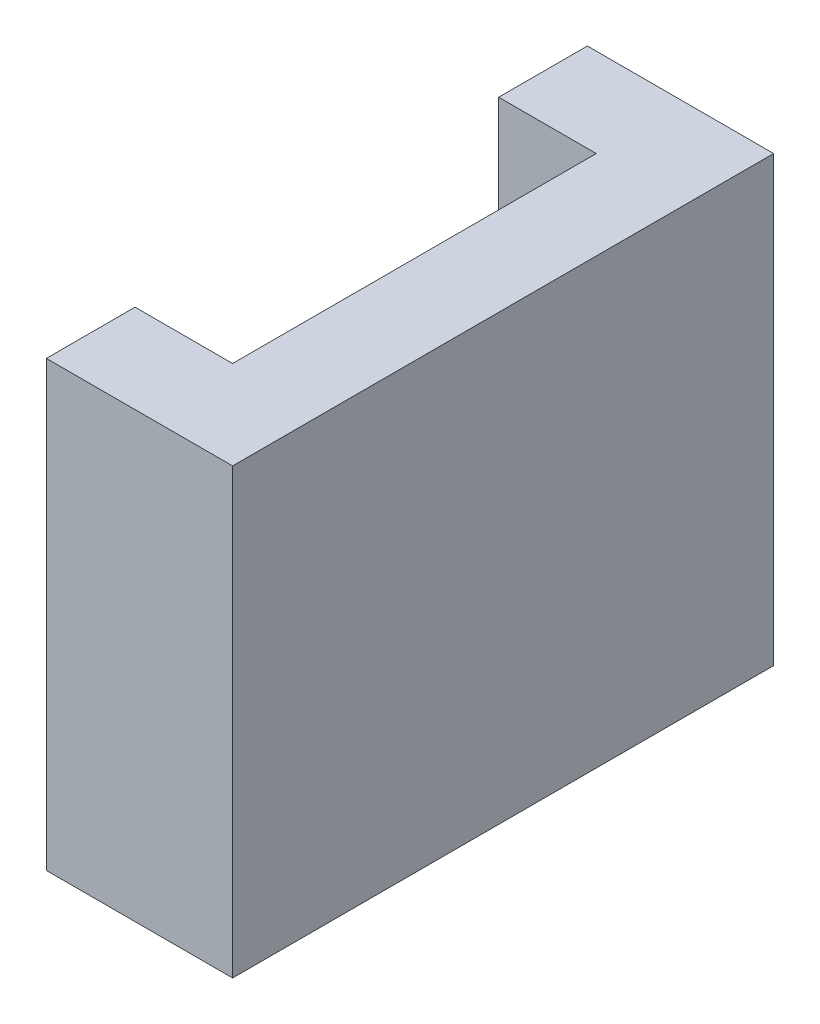
from build123d import *

# Parameters (mm, degrees)
BOSS_EXTRUDE1_DEPTH = 5.5
SKETCH2_W           = 30.5
SKETCH2_H           = 25
BOSS_EXTRUDE2_DEPTH = 5


with BuildPart() as part:
    # Sketch1 → Boss-Extrude1 (new body)
    with BuildSketch(Plane(origin=(0, 0, 0), x_dir=(0, 0, -1), z_dir=(1, 0, 0))):
        Polygon((-14.845360825, -6.858679442), (-14.845360825, 13.141320558), (-19.845360825, 13.141320558), (-19.845360825, -11.858679442), (10.654639175, -11.858679442), (10.654639175, 13.141320558), (5.654639175, 13.141320558), (5.654639175, -6.858679442), align=None)
    extrude(amount=BOSS_EXTRUDE1_DEPTH)

    # Sketch2 → Boss-Extrude2 (add)
    with BuildSketch(Plane(origin=(5.5, 0, 0), x_dir=(0, 0, -1), z_dir=(1, 0, 0))):
        with Locations((-4.595360825, 0.641320558)):
            Rectangle(SKETCH2_W, SKETCH2_H)
    extrude(amount=BOSS_EXTRUDE2_DEPTH)


solid = part.part
